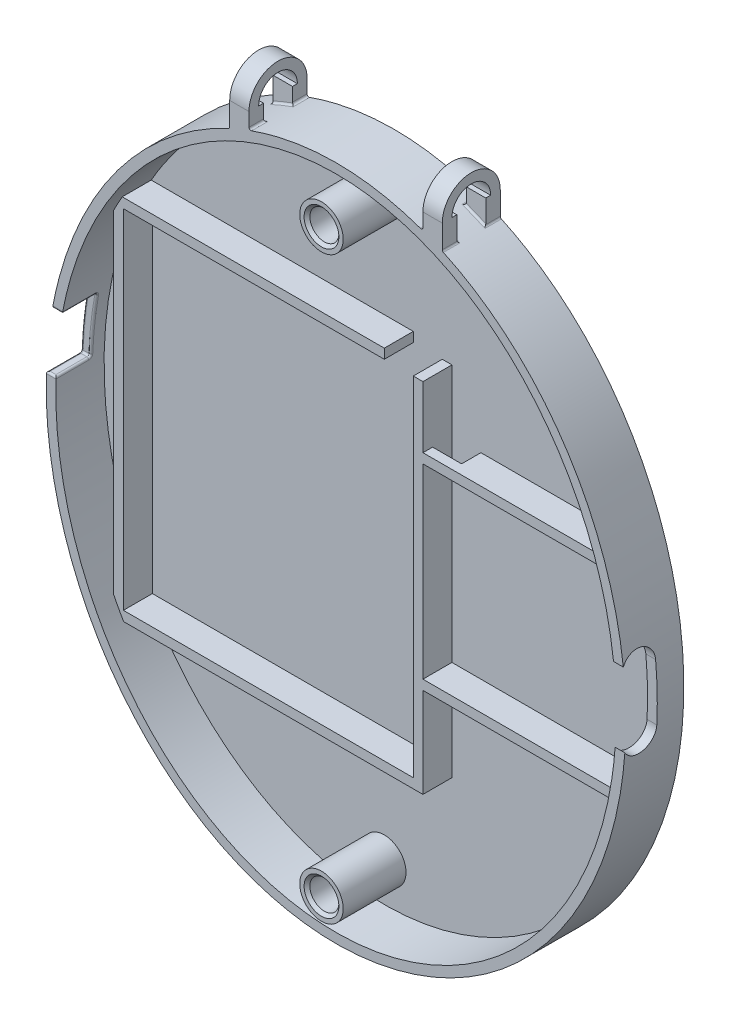
from build123d import *

# Parameters (mm, degrees)
SKETCH2_RX                 = 35
SKETCH2_RY                 = 30
BASE_EXTRUDE_DEPTH         = 6
SKETCH4_RX                 = 34
SKETCH4_RY                 = 29
CUT_BASE_DEPTH             = 5
CUT_USB_REACH              = 71.287
CUT_USB_DIRECTION_2_DEPTH  = 70.287417725
SCREW_EXTRUDE1_START       = -0.5
SKETCH8_R                  = 2.25
SKETCH8_R_2                = 1.5
SCREW_EXTRUDE1_DEPTH       = 7
CHAMFER1_SIZE              = 0.3
LPATTERN1_COUNT            = 2
LPATTERN1_PITCH            = 60
CHAMFER1_OF_LPATTERN1_SIZE = 0.3
BOSS_EXTRUDE4_START        = -2.6
SKETCH13_W                 = 2
SKETCH13_H                 = 1.5
BOSS_EXTRUDE4_DEPTH        = 2.68
BOSS_EXTRUDE5_DEPTH        = 2
LPATTERN2_COUNT            = 2
LPATTERN2_PITCH            = 20
CUT_BT_REACH               = 73.475
SKETCH16_W                 = 3.6
SKETCH16_H                 = 6
FILLET2_R                  = 0.2
SKETCH17_W                 = 32
SKETCH17_H                 = 38
SKETCH17_W_2               = 30
SKETCH17_H_2               = 36
BATTERYHOLDER_DEPTH        = 3
SKETCH20_W                 = 4
SKETCH20_H                 = 3
BATTERY_CABLE2_DEPTH       = 1
SKETCH22_W                 = 20.581848184
SKETCH22_H                 = 1
SKETCH22_W_2               = 21
BOSS_EXTRUDE9_DEPTH        = 3
SKETCH23_W                 = 3
SKETCH23_H                 = 2
CUT_EXTRUDE6_DEPTH         = 1


with BuildPart() as part:
    # Sketch2 → Base-Extrude (new body)
    with BuildSketch(Plane.XY):
        with Locations(Location((0.004233302, 0), (0, 0, 90))):
            Ellipse(SKETCH2_RX, SKETCH2_RY)
    extrude(amount=BASE_EXTRUDE_DEPTH)

    # Sketch4 → Cut-Base (cut)
    with BuildSketch(Plane.XY.offset(6)):
        with Locations(Location((0, 0), (0, 0, -90))):
            Ellipse(SKETCH4_RX, SKETCH4_RY)
    extrude(amount=-CUT_BASE_DEPTH, mode=Mode.SUBTRACT)

    # Sketch7 → Cut-USB (cut, up to next)
    with BuildSketch(Plane(origin=(29.5, 0, 0), x_dir=(0, 0, -1), z_dir=(1, 0, 0)), mode=Mode.PRIVATE) as cut_usb_sk1:
        with BuildLine():
            Line((-2.75, 3.752213586), (-2.75, -2.047786414))
            ThreePointArc((-2.75, -2.047786414), (-4.5, -3.797786414), (-6.25, -2.047786414))
            Line((-6.25, -2.047786414), (-6.25, 3.752213586))
            ThreePointArc((-6.25, 3.752213586), (-4.5, 5.502213586), (-2.75, 3.752213586))
        make_face()
    cut_usb_tool1 = extrude(cut_usb_sk1.sketch, amount=-CUT_USB_REACH, mode=Mode.PRIVATE) & part.part
    add(cut_usb_tool1.solids().sort_by_distance((29.5, 0.852214, 4.5))[0], mode=Mode.SUBTRACT)

    # Sketch7 → Cut-USB direction 2 (cut)
    with BuildSketch(Plane(origin=(29.5, 0, 0), x_dir=(0, 0, -1), z_dir=(1, 0, 0))):
        with BuildLine():
            Line((-2.75, 3.752213586), (-2.75, -2.047786414))
            ThreePointArc((-2.75, -2.047786414), (-4.5, -3.797786414), (-6.25, -2.047786414))
            Line((-6.25, -2.047786414), (-6.25, 3.752213586))
            ThreePointArc((-6.25, 3.752213586), (-4.5, 5.502213586), (-2.75, 3.752213586))
        make_face()
    extrude(amount=CUT_USB_DIRECTION_2_DEPTH, mode=Mode.SUBTRACT)

    # Sketch8 → Screw-Extrude1 (add)
    with BuildSketch(Plane.XY.offset(1).offset(SCREW_EXTRUDE1_START)):
        with Locations((0, -30)):
            Circle(SKETCH8_R)
        with Locations((0, -30)):
            Circle(SKETCH8_R_2, mode=Mode.SUBTRACT)
    screw_extrude1 = extrude(amount=SCREW_EXTRUDE1_DEPTH)

    # Chamfer1
    chamfer1_edges = [part.edges().sort_by_distance(p)[0] for p in [
        (-1.5, -30, 7.5),
    ]]
    chamfer(chamfer1_edges, length=CHAMFER1_SIZE)

    # LPattern1: Screw-Extrude1 ×2
    with Locations(*[(0, i * LPATTERN1_PITCH, 0) for i in range(1, LPATTERN1_COUNT)]):
        add(screw_extrude1)

    # Chamfer1 of LPattern1
    chamfer1_of_lpattern1_edges = [part.edges().sort_by_distance(p)[0] for p in [
        (-1.5, 30, 7.5),
    ]]
    chamfer(chamfer1_of_lpattern1_edges, length=CHAMFER1_OF_LPATTERN1_SIZE)

    # Sketch13 → Boss-Extrude4 (add)
    with BuildSketch(Plane(origin=(0, 35, 0), x_dir=(1, 0, 0), z_dir=(0, 1, 0)).offset(BOSS_EXTRUDE4_START)):
        with Locations((-9.995766698, -5.25)):
            Rectangle(SKETCH13_W, SKETCH13_H)
        with Locations((-9.995766698, -0.75)):
            Rectangle(SKETCH13_W, SKETCH13_H)
    boss_extrude4 = extrude(amount=BOSS_EXTRUDE4_DEPTH)

    # Sketch15 → Boss-Extrude5 (add)
    with BuildSketch(Plane.ZY.offset(10.995766698)):
        with BuildLine():
            ThreePointArc((6, 35), (3.001775709, 38.103204182), (0.003551419, 35))
            Line((0.003551419, 35), (1.00444026, 35))
            ThreePointArc((1.00444026, 35), (3.001775709, 37.103204182), (4.999111159, 35))
            Line((4.999111159, 35), (6, 35))
        make_face()
    boss_extrude5 = extrude(amount=-BOSS_EXTRUDE5_DEPTH)

    # LPattern2: Boss-Extrude4, Boss-Extrude5 ×2
    with Locations(*[(i * LPATTERN2_PITCH, 0, 0) for i in range(1, LPATTERN2_COUNT)]):
        add(boss_extrude4)
        add(boss_extrude5)

    # Sketch16 → Cut-BT (cut, up to next)
    with BuildSketch(Plane(origin=(-30, 0, 0), x_dir=(0, 0, -1), z_dir=(1, 0, 0)), mode=Mode.PRIVATE) as cut_bt_sk1:
        with Locations((-4.2, 4.311970852)):
            Rectangle(SKETCH16_W, SKETCH16_H)
    cut_bt_tool1 = extrude(cut_bt_sk1.sketch, amount=CUT_BT_REACH, mode=Mode.PRIVATE) & part.part
    add(cut_bt_tool1.solids().sort_by_distance((-30, 4.311971, 4.2))[0], mode=Mode.SUBTRACT)

    # Fillet2
    fillet2_edges = [part.edges().sort_by_distance(p)[0] for p in [
        (-29.974682544, 1.311970852, 4.2),
        (-28.978401664, 1.311970852, 4.2),
        (-29.476542104, 1.311970852, 2.4),
        (-29.476542104, 1.311970852, 6),
        (-29.333790699, 7.311970852, 4.2),
        (-28.827613991, 7.311970852, 6),
        (-28.827613991, 7.311970852, 2.4),
        (-28.321437284, 7.311970852, 4.2),
        (-29.765953434, 4.323909864, 2.4),
        (-28.764466216, 4.324519853, 2.4),
        (9.004233302, 33.38787205, 5.25),
        (10.012419856, 32.994938113, 4.5),
        (11.004233302, 32.562333386, 5.25),
        (10.012419856, 32.994938113, 1.5),
        (9.004233302, 33.38787205, 0.75),
        (11.004233302, 32.562333386, 0.75),
        (-8.995766698, 33.38787205, 5.25),
        (-8.995766698, 33.38787205, 0.75),
        (-10.003953252, 32.994938113, 4.5),
        (-10.995766698, 32.562333386, 5.25),
        (-10.995766698, 32.562333386, 0.75),
        (-10.003953252, 32.994938113, 1.5),
    ]]
    fillet(fillet2_edges, radius=FILLET2_R)

    # Sketch17 → BatteryHolder (add)
    with BuildSketch(Plane.XY.offset(1)):
        with Locations((-9, -0.126194991)):
            Rectangle(SKETCH17_W, SKETCH17_H)
        with Locations((-9, -0.126194991)):
            Rectangle(SKETCH17_W_2, SKETCH17_H_2, mode=Mode.SUBTRACT)
    extrude(amount=BATTERYHOLDER_DEPTH)

    # Sketch20 → Battery_Cable2 (cut)
    with BuildSketch(Plane(origin=(0, 18.873805009, 0), x_dir=(1, 0, 0), z_dir=(0, 1, 0))):
        with Locations((5, -2.5)):
            Rectangle(SKETCH20_W, SKETCH20_H)
    extrude(amount=-BATTERY_CABLE2_DEPTH, mode=Mode.SUBTRACT)

    # Sketch22 → Boss-Extrude9 (add)
    with BuildSketch(Plane.XY.offset(1)):
        with Locations((17.290924092, 11.002213586)):
            Rectangle(SKETCH22_W, SKETCH22_H)
        with Locations((17.5, -9.297786414)):
            Rectangle(SKETCH22_W_2, SKETCH22_H)
    extrude(amount=BOSS_EXTRUDE9_DEPTH)

    # Sketch23 → Cut-Extrude6 (cut)
    with BuildSketch(Plane.XZ.offset(-10.502213586)):
        with Locations((8.5, 2)):
            Rectangle(SKETCH23_W, SKETCH23_H)
    extrude(amount=-CUT_EXTRUDE6_DEPTH, mode=Mode.SUBTRACT)


solid = part.part
